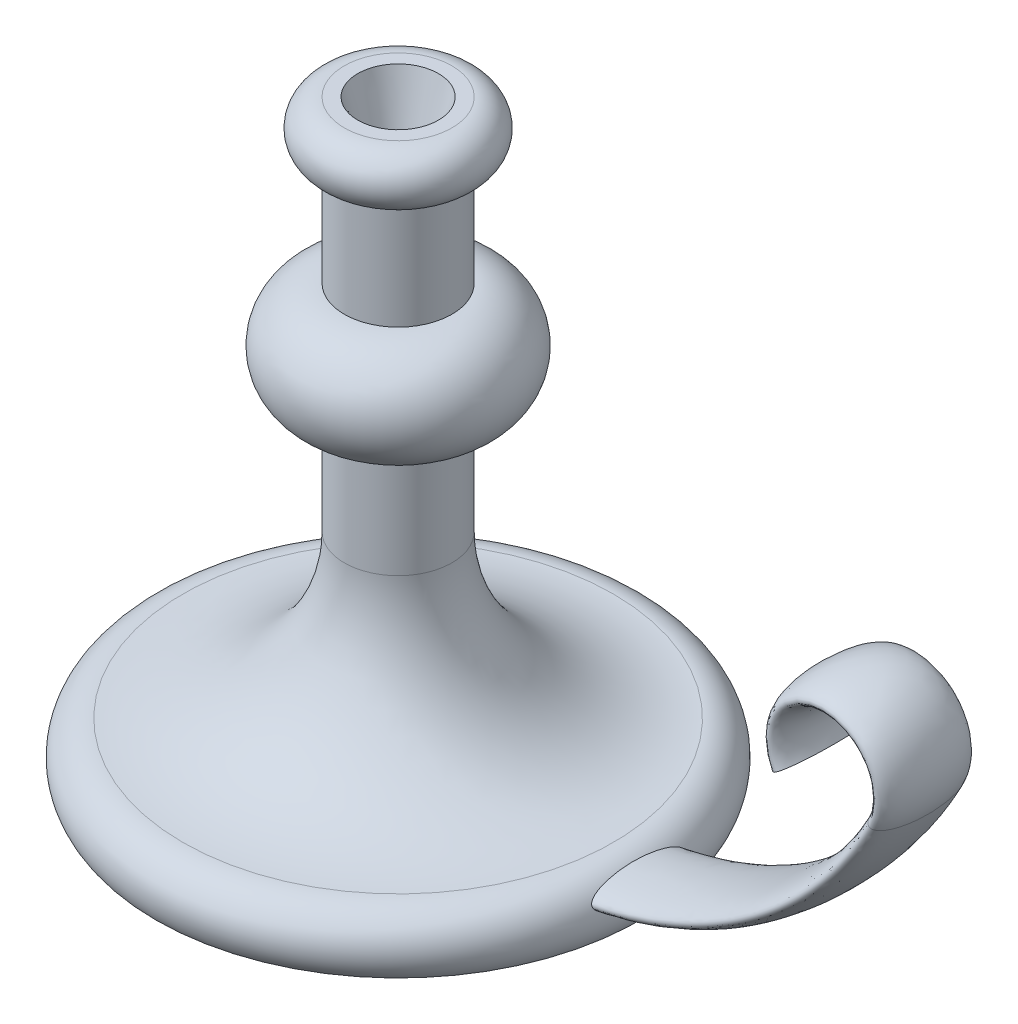
from build123d import *

# Parameters (mm, degrees)
SZKIC3_RX                  = 17.5
SZKIC3_RY                  = 5
SZKIC4_R                   = 15
WYTNIJ_WYCI_GNI_CIE3_DEPTH = 25
WYTNIJ_WYCI_GNI_CIE3_DRAFT = -15


with BuildPart() as part:
    # Szkic1 → Obrót1 (revolve)
    with BuildSketch(Plane.XY, mode=Mode.PRIVATE) as obr_t1_sk:
        with BuildLine():
            Line((0, 0), (0, 220))
            Line((0, 220), (20, 220))
            ThreePointArc((20, 220), (30, 210), (20, 200))
            Line((20, 200), (20, 160))
            ThreePointArc((20, 160), (40, 140), (20, 120))
            Line((20, 120), (20, 80))
            ThreePointArc((20, 80), (37.573593129, 37.573593129), (80, 20))
            ThreePointArc((80, 20), (91.180339887, 13.090169944), (90, 0))
            Line((90, 0), (0, 0))
        make_face()
    revolve(obr_t1_sk.sketch.rotate(Axis((0, 0, 0), (0, 1, 0)), 90), axis=Axis((0, 0, 0), (0, 1, 0)))

    # Wyciągnięcie po ścieżce1: sweep along a path in Szkic2
    with BuildLine(Plane.XY) as wyci_gni_cie_po_cie_ce1_path:
        Line((0, 10), (60, 10))
        ThreePointArc((60, 10), (137.457659145, 31.546463499), (192.662803285, 89.995852804))
        ThreePointArc((192.662803285, 89.995852804), (174.974429513, 119.329739097), (157.286055742, 89.995852804))
    # Szkic3 → Wyciągnięcie po ścieżce1 (sweep)
    with BuildSketch(Plane(origin=(0, 0, 0), x_dir=(0, 0, -1), z_dir=(1, 0, 0))):
        with Locations(Location((0, 10), (0, 0, 180))):
            Ellipse(SZKIC3_RX, SZKIC3_RY)
    sweep(path=wyci_gni_cie_po_cie_ce1_path.line)


with BuildPart() as wytnij_wyci_gni_cie3_tool:
    # Szkic4 → Wytnij-wyciągnięcie3 (with draft: the straight prism first)
    with BuildSketch(Plane(origin=(0, 220, 0), x_dir=(1, 0, 0), z_dir=(0, 1, 0))):
        Circle(SZKIC4_R)
    extrude(amount=-WYTNIJ_WYCI_GNI_CIE3_DEPTH)
    # Wytnij-wyciągnięcie3: the draft: its side faces are tilted about the plane it starts from
    wytnij_wyci_gni_cie3_sides = [wytnij_wyci_gni_cie3_tool.faces().sort_by_distance(p)[0] for p in [
        (-15, 207.5, 0),
    ]]
    draft(wytnij_wyci_gni_cie3_sides, Plane(origin=(0, 220, 0), x_dir=(1, 0, 0), z_dir=(0, 1, 0)), WYTNIJ_WYCI_GNI_CIE3_DRAFT)


with BuildPart() as part_1:
    add(part.part)

    # Wytnij-wyciągnięcie3: cut by wytnij_wyci_gni_cie3_tool
    add(wytnij_wyci_gni_cie3_tool.part, mode=Mode.SUBTRACT)


solid = part_1.part
